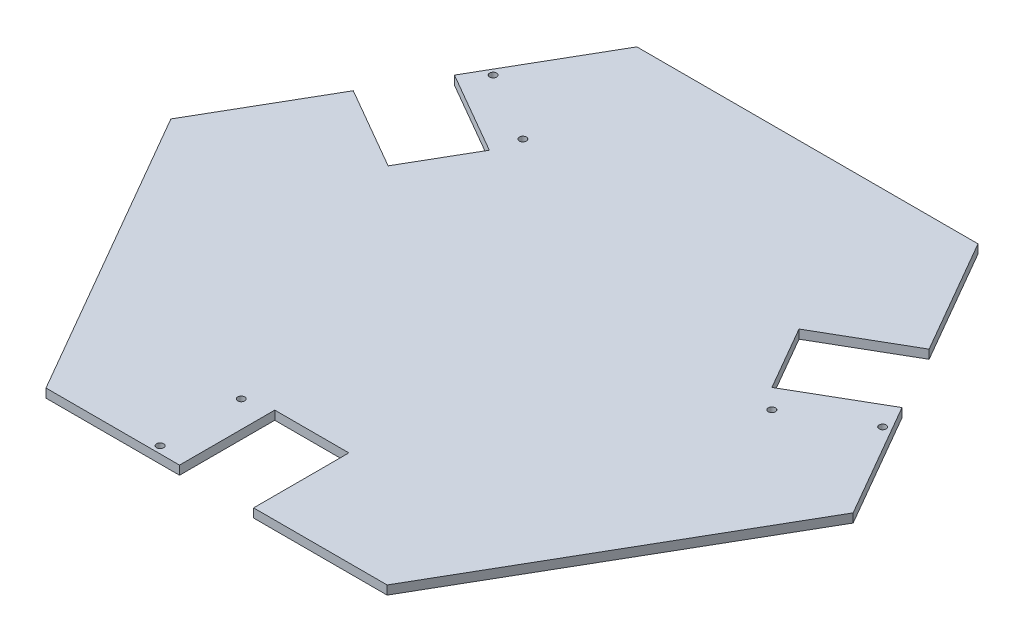
from build123d import *

# Parameters (mm, degrees)
SKETCH1_R           = 2
BOSS_EXTRUDE1_DEPTH = 5


with BuildPart() as part:
    # Sketch1 → Boss-Extrude1 (new body)
    with BuildSketch(Plane(origin=(0, 0, 0), x_dir=(1, 0, 0), z_dir=(0, 1, 0))):
        Polygon((-96.706170089, 167.5), (-134.559255134, 101.936533479), (-87.79388333, 74.936533479), (-108.79388333, 38.563466521), (-155.559255134, 65.563466521), (-193.412340179, 0), (-96.706170089, -167.5), (-21, -167.5), (-21, -113.5), (21, -113.5), (21, -167.5), (96.706170089, -167.5), (193.412340179, 0), (155.559255134, 65.563466521), (108.79388333, 38.563466521), (87.79388333, 74.936533479), (134.559255134, 101.936533479), (96.706170089, 167.5), align=None)
        with Locations(Location((-36, -163.5, 0), (0, 0, 270))):
            Circle(SKETCH1_R, mode=Mode.SUBTRACT)
        with Locations(Location((-36, -117.5, 0), (0, 0, 270))):
            Circle(SKETCH1_R, mode=Mode.SUBTRACT)
        with Locations(Location((-123.595153519, 112.926914536, 0), (0, 0, 270))):
            Circle(SKETCH1_R, mode=Mode.SUBTRACT)
        with Locations(Location((-83.757984945, 89.926914536, 0), (0, 0, 270))):
            Circle(SKETCH1_R, mode=Mode.SUBTRACT)
        with Locations(Location((159.595153519, 50.573085464, 0), (0, 0, 270))):
            Circle(SKETCH1_R, mode=Mode.SUBTRACT)
        with Locations(Location((119.757984945, 27.573085464, 0), (0, 0, 270))):
            Circle(SKETCH1_R, mode=Mode.SUBTRACT)
    extrude(amount=BOSS_EXTRUDE1_DEPTH)


solid = part.part
